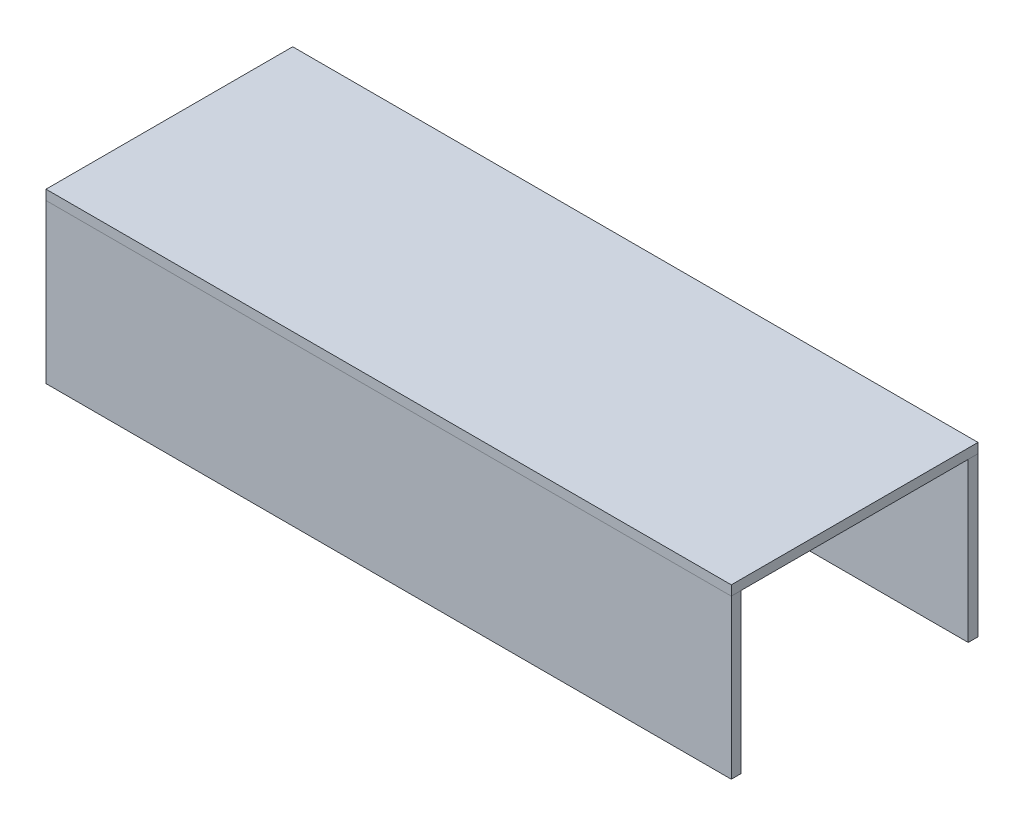
from build123d import *

# Parameters (mm, degrees)
SKETCH4_W           = 6300
SKETCH4_H           = 250
BOSS_EXTRUDE4_DEPTH = 17500
SKETCH6_W           = 250
SKETCH6_H           = 4050
BOSS_EXTRUDE5_DEPTH = 17500
SKETCH7_W           = 250
SKETCH7_H           = 4050
BOSS_EXTRUDE6_DEPTH = 17500


with BuildPart() as part:
    # Sketch4 → Boss-Extrude4 (new body)
    with BuildSketch(Plane(origin=(0, 0, 0), x_dir=(0, 0, -1), z_dir=(1, 0, 0))):
        with Locations((-3150, -125)):
            Rectangle(SKETCH4_W, SKETCH4_H)
    extrude(amount=BOSS_EXTRUDE4_DEPTH)


with BuildPart() as body_2:
    # Sketch6 → Boss-Extrude5 (new body)
    with BuildSketch(Plane(origin=(0, 0, 0), x_dir=(0, 0, -1), z_dir=(1, 0, 0))):
        with Locations((-6175, -2275)):
            Rectangle(SKETCH6_W, SKETCH6_H)
    extrude(amount=BOSS_EXTRUDE5_DEPTH)


with BuildPart() as body_3:
    # Sketch7 → Boss-Extrude6 (new body)
    with BuildSketch(Plane(origin=(0, 0, 0), x_dir=(0, 0, -1), z_dir=(1, 0, 0))):
        with Locations((-125, -2275)):
            Rectangle(SKETCH7_W, SKETCH7_H)
    extrude(amount=BOSS_EXTRUDE6_DEPTH)


solid = Compound([part.part, body_2.part, body_3.part])
